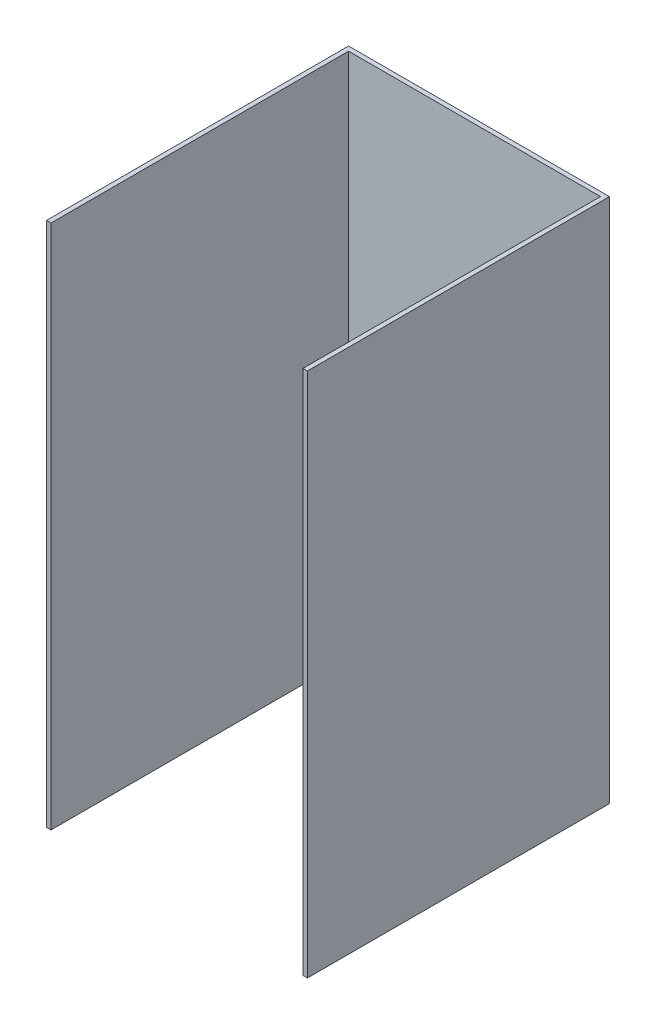
from build123d import *

# Parameters (mm, degrees)
BOSS_EXTRUDE2_DEPTH = 269.24


with BuildPart() as part:
    # Sketch1 → Boss-Extrude2 (new body)
    with BuildSketch(Plane(origin=(0, 0, 0), x_dir=(1, 0, 0), z_dir=(0, 1, 0))):
        Polygon((131.318, 2.286), (131.318, -152.4), (129.032, -152.4), (129.032, 0), (0, 0), (0, -152.4), (-2.286, -152.4), (-2.286, 2.286), align=None)
    extrude(amount=BOSS_EXTRUDE2_DEPTH)


solid = part.part
